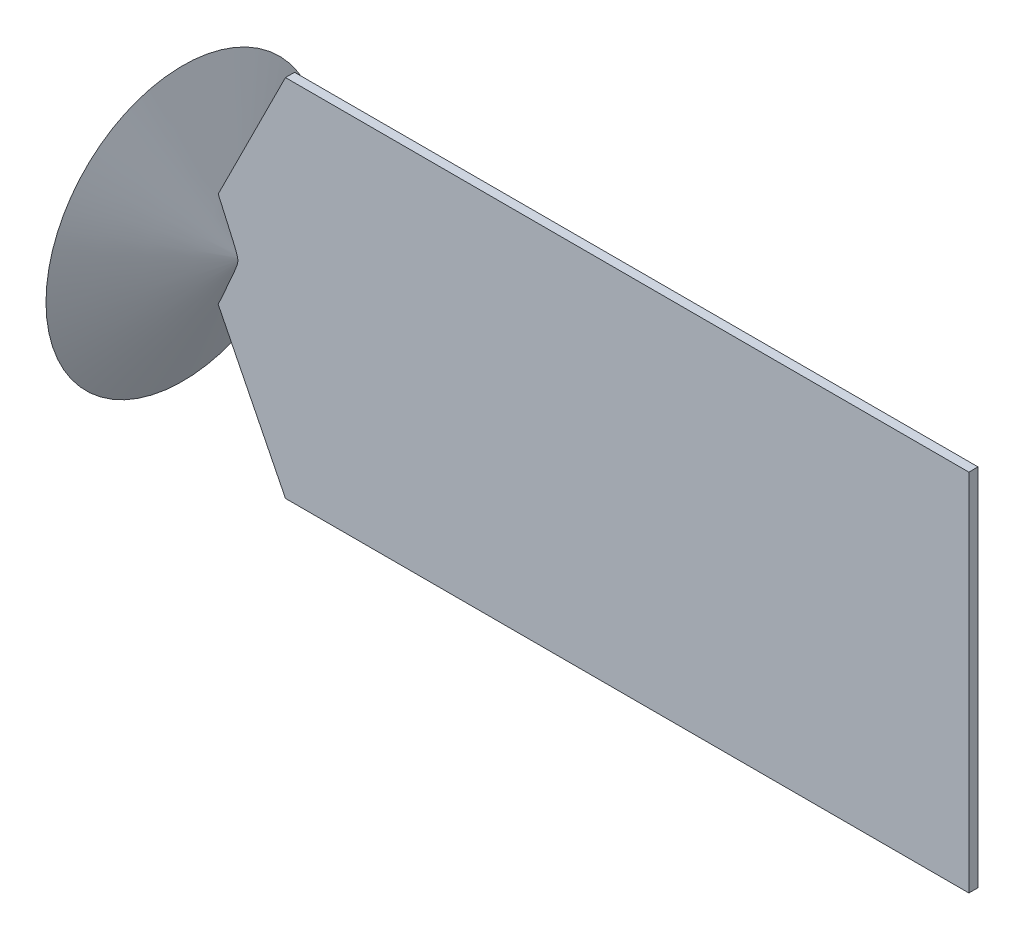
from build123d import *

# Parameters (mm, degrees)
EXTRUDE_2_DEPTH = 1


with BuildPart() as part:
    # 草图2 → 凸台-拉伸2 (new, symmetric)
    with BuildSketch(Plane.XY):
        Polygon((-75, 40), (75, 40), (75, -40), (-75, -40), (-95, 0), align=None)
    extrude(amount=EXTRUDE_2_DEPTH, both=True)

    # 草图2<5> → 旋转5 (revolve)
    with BuildSketch(Plane.XY):
        Polygon((-85, 0), (-98.554984954, 30), (-98.554984954, 0), align=None)
    revolve(axis=Axis((-1003.811687892, 0, 0), (1, 0, 0)))


solid = part.part
